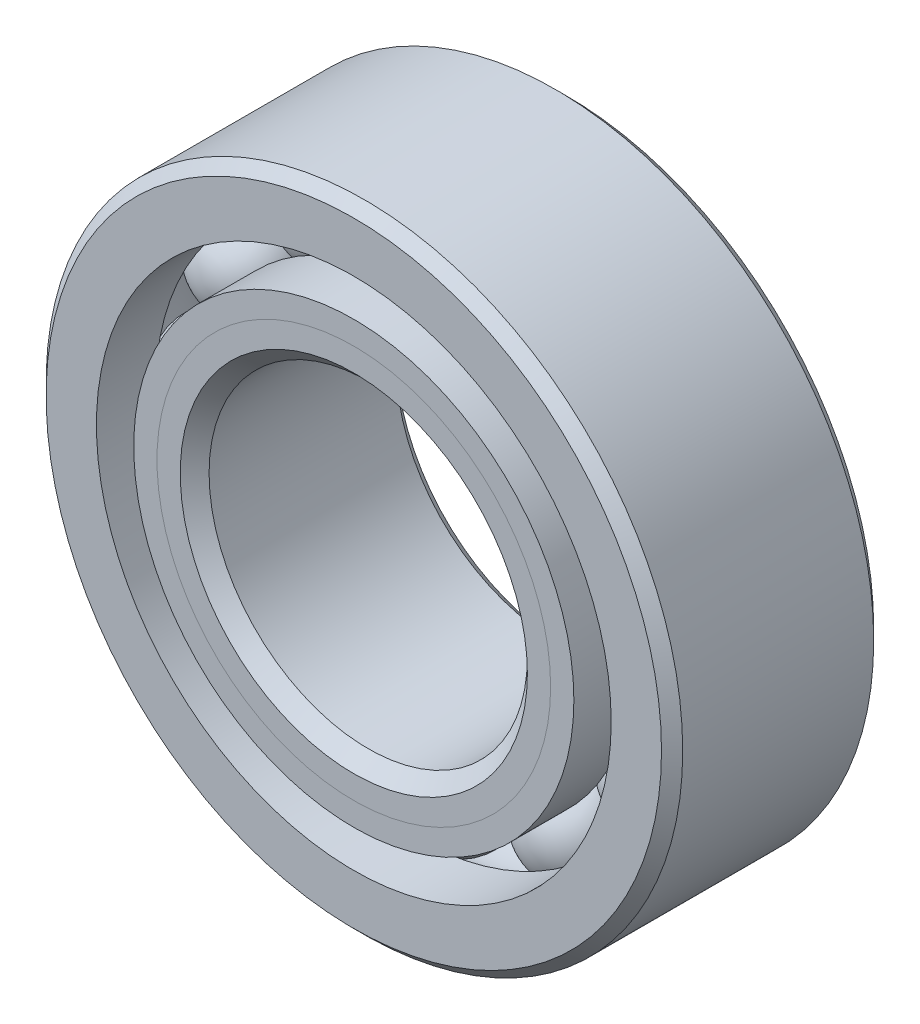
from build123d import *

# Parameters (mm, degrees)
CIRPATTERN1_COUNT = 12


with BuildPart() as part:
    # Sketch1 → Revolve1 (revolve)
    with BuildSketch(Plane(origin=(0, 0, 0), x_dir=(0, 0, -1), z_dir=(1, 0, 0))):
        with BuildLine():
            Line((1.42875, 4.7625), (-1.42875, 4.7625))
            Line((-1.42875, 4.7625), (-1.5875, 4.60375))
            Line((-1.5875, 4.60375), (-1.5875, 3.850995879))
            Line((-1.5875, 3.850995879), (-0.705555556, 3.850995879))
            ThreePointArc((-0.705555556, 3.850995879), (0, 4.330635244), (0.705555556, 3.850995879))
            Line((0.705555556, 3.850995879), (1.5875, 3.850995879))
            Line((1.5875, 3.850995879), (1.5875, 4.60375))
            Line((1.5875, 4.60375), (1.42875, 4.7625))
        make_face()
    revolve(axis=Axis((0, 0, 1.5875), (0, 0, -1)))


with BuildPart() as body_2:
    # Sketch2 → Revolve2 (revolve)
    with BuildSketch(Plane(origin=(0, 0, 0), x_dir=(0, 0, -1), z_dir=(1, 0, 0))):
        with BuildLine():
            Line((-1.5875, 3.292754121), (-0.705555556, 3.292754121))
            ThreePointArc((-0.705555556, 3.292754121), (-0.426574308, 2.944378811), (0, 2.813114756))
            Line((0, 2.813114756), (0, 2.597182378))
            Line((0, 2.597182378), (-1.239714129, 2.597182378))
            Line((-1.239714129, 2.597182378), (-1.5875, 2.94496825))
            Line((-1.5875, 2.94496825), (-1.5875, 3.292754121))
        make_face()
    revolve(axis=Axis((0, 0, 1.5875), (0, 0, -1)))


with BuildPart() as body_3:
    # Sketch3 → Revolve3 (revolve)
    with BuildSketch(Plane(origin=(0, 0, 0), x_dir=(0, 0, -1), z_dir=(1, 0, 0))):
        with BuildLine():
            Line((-1.5875, 2.94496825), (-1.239714129, 2.597182378))
            Line((-1.239714129, 2.597182378), (0, 2.597182378))
            Line((0, 2.597182378), (0, 2.813114756))
            ThreePointArc((0, 2.813114756), (0.426574308, 2.944378811), (0.705555556, 3.292754121))
            Line((0.705555556, 3.292754121), (1.5875, 3.292754121))
            Line((1.5875, 3.292754121), (1.5875, 2.54))
            Line((1.5875, 2.54), (1.42875, 2.38125))
            Line((1.42875, 2.38125), (-1.371567622, 2.38125))
            Line((-1.371567622, 2.38125), (-1.5875, 2.597182378))
            Line((-1.5875, 2.597182378), (-1.5875, 2.94496825))
        make_face()
    revolve(axis=Axis((0, 0, 1.5875), (0, 0, -1)))


with BuildPart() as body_4:
    # Sketch4 → Revolve4 (revolve)
    with BuildSketch(Plane(origin=(0, 0, 0), x_dir=(0, 0, -1), z_dir=(1, 0, 0))):
        with BuildLine():
            Line((-0.758760244, 3.571875), (0.758760244, 3.571875))
            ThreePointArc((0.758760244, 3.571875), (0, 4.330635244), (-0.758760244, 3.571875))
        make_face()
    revolve(axis=Axis((0, 3.571875, 0.758760244), (0, 0, -1)))


with BuildPart() as cirpattern1_1:
    # CirPattern1: pattern copy
    add(body_4.part.rotate(Axis((0, 0, -1.5875), (0, 0, 1)), 1 * 360 / CIRPATTERN1_COUNT))


with BuildPart() as cirpattern1_2:
    # CirPattern1: pattern copy
    add(body_4.part.rotate(Axis((0, 0, -1.5875), (0, 0, 1)), 2 * 360 / CIRPATTERN1_COUNT))


with BuildPart() as cirpattern1_3:
    # CirPattern1: pattern copy
    add(body_4.part.rotate(Axis((0, 0, -1.5875), (0, 0, 1)), 3 * 360 / CIRPATTERN1_COUNT))


with BuildPart() as cirpattern1_4:
    # CirPattern1: pattern copy
    add(body_4.part.rotate(Axis((0, 0, -1.5875), (0, 0, 1)), 4 * 360 / CIRPATTERN1_COUNT))


with BuildPart() as cirpattern1_5:
    # CirPattern1: pattern copy
    add(body_4.part.rotate(Axis((0, 0, -1.5875), (0, 0, 1)), 5 * 360 / CIRPATTERN1_COUNT))


with BuildPart() as cirpattern1_6:
    # CirPattern1: pattern copy
    add(body_4.part.rotate(Axis((0, 0, -1.5875), (0, 0, 1)), 6 * 360 / CIRPATTERN1_COUNT))


with BuildPart() as cirpattern1_7:
    # CirPattern1: pattern copy
    add(body_4.part.rotate(Axis((0, 0, -1.5875), (0, 0, 1)), 7 * 360 / CIRPATTERN1_COUNT))


with BuildPart() as cirpattern1_8:
    # CirPattern1: pattern copy
    add(body_4.part.rotate(Axis((0, 0, -1.5875), (0, 0, 1)), 8 * 360 / CIRPATTERN1_COUNT))


with BuildPart() as cirpattern1_9:
    # CirPattern1: pattern copy
    add(body_4.part.rotate(Axis((0, 0, -1.5875), (0, 0, 1)), 9 * 360 / CIRPATTERN1_COUNT))


with BuildPart() as cirpattern1_10:
    # CirPattern1: pattern copy
    add(body_4.part.rotate(Axis((0, 0, -1.5875), (0, 0, 1)), 10 * 360 / CIRPATTERN1_COUNT))


with BuildPart() as cirpattern1_11:
    # CirPattern1: pattern copy
    add(body_4.part.rotate(Axis((0, 0, -1.5875), (0, 0, 1)), 11 * 360 / CIRPATTERN1_COUNT))


solid = Compound([part.part, body_2.part, body_3.part, body_4.part, cirpattern1_1.part, cirpattern1_2.part, cirpattern1_3.part, cirpattern1_4.part, cirpattern1_5.part, cirpattern1_6.part, cirpattern1_7.part, cirpattern1_8.part, cirpattern1_9.part, cirpattern1_10.part, cirpattern1_11.part])
